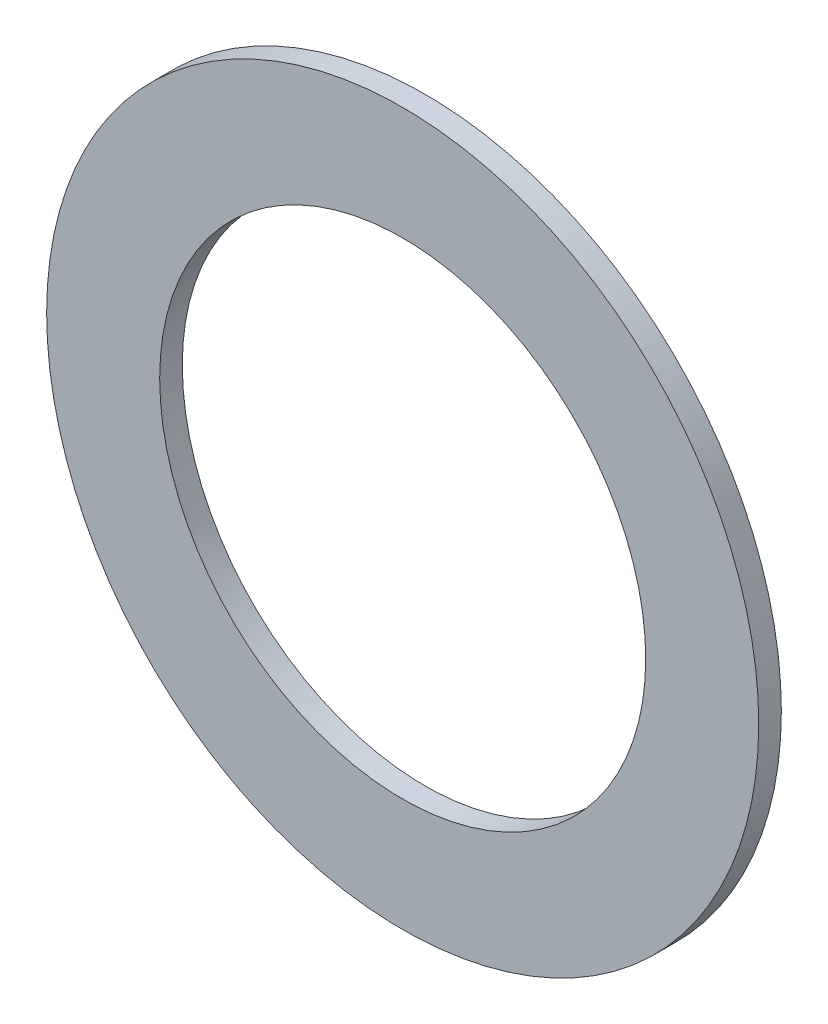
from build123d import *

# Parameters (mm, degrees)
SKETCH1_R           = 15.75
SKETCH1_R_2         = 10.75
BOSS_EXTRUDE1_DEPTH = 1


with BuildPart() as part:
    # Sketch1 → Boss-Extrude1 (new body)
    with BuildSketch(Plane.XY):
        Circle(SKETCH1_R)
        Circle(SKETCH1_R_2, mode=Mode.SUBTRACT)
    extrude(amount=BOSS_EXTRUDE1_DEPTH)


solid = part.part
